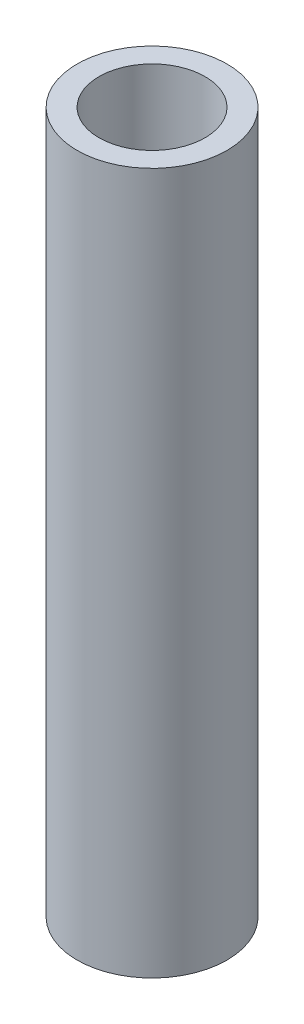
from build123d import *

# Parameters (mm, degrees)
SKETCH1_R           = 8.55
SKETCH1_R_2         = 6.05
EXTRUDE_THIN1_DEPTH = 80


with BuildPart() as part:
    # Sketch1 → Extrude-Thin1 (new body)
    with BuildSketch(Plane(origin=(0, 0, 0), x_dir=(1, 0, 0), z_dir=(0, 1, 0))):
        Circle(SKETCH1_R)
        Circle(SKETCH1_R_2, mode=Mode.SUBTRACT)
    extrude(amount=EXTRUDE_THIN1_DEPTH)


solid = part.part
